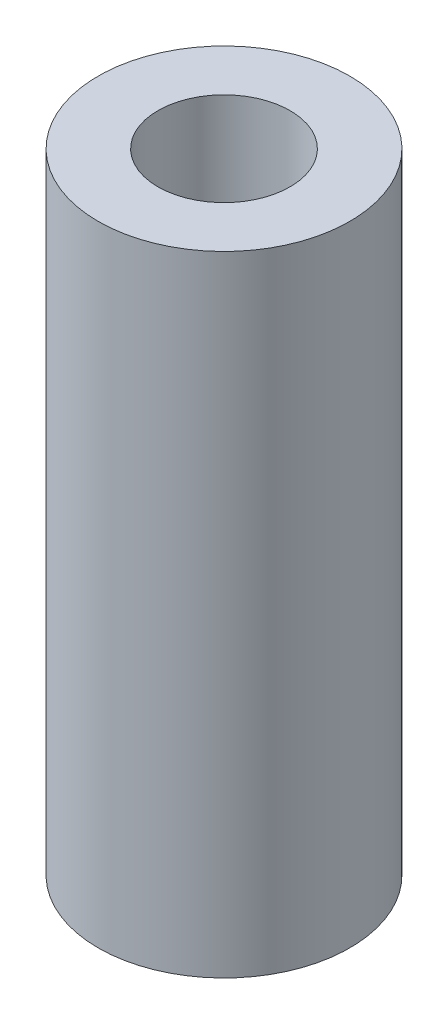
from build123d import *

# Parameters (mm, degrees)
SKETCH1_R           = 4
SKETCH1_R_2         = 2.1
BOSS_EXTRUDE1_DEPTH = 20


with BuildPart() as part:
    # Sketch1 → Boss-Extrude1 (new body)
    with BuildSketch(Plane(origin=(0, 0, 0), x_dir=(1, 0, 0), z_dir=(0, 1, 0))):
        with Locations(Location((0, 0, 0), (0, 0, 270))):
            Circle(SKETCH1_R)
        with Locations(Location((0, 0, 0), (0, 0, 270))):
            Circle(SKETCH1_R_2, mode=Mode.SUBTRACT)
    extrude(amount=BOSS_EXTRUDE1_DEPTH)


solid = part.part
